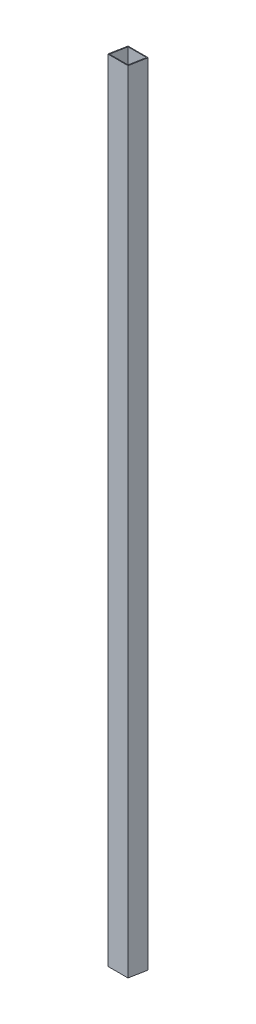
from build123d import *

# Parameters (mm, degrees)
SKETCH1_W           = 25
SKETCH1_H           = 25
SKETCH1_W_2         = 23
SKETCH1_H_2         = 23
BOSS_EXTRUDE1_DEPTH = 1200
CUT_EXTRUDE1_DEPTH  = 1201.325476694


with BuildPart() as part:
    # Sketch1 → Boss-Extrude1 (new body)
    with BuildSketch(Plane(origin=(0, 0, 0), x_dir=(1, 0, 0), z_dir=(0, 1, 0))):
        Rectangle(SKETCH1_W, SKETCH1_H)
        Rectangle(SKETCH1_W_2, SKETCH1_H_2, mode=Mode.SUBTRACT)
    extrude(amount=BOSS_EXTRUDE1_DEPTH)

    # Sketch2 → Cut-Extrude1 (cut, through all)
    with BuildSketch(Plane(origin=(12.5, 0, 0), x_dir=(0, 0, -1), z_dir=(1, 0, 0))):
        Polygon((12.5, 0), (-12.5, 3.959611008), (-12.5, 0), align=None)
        Polygon((12.5, 1200), (-12.5, 1200), (-12.5, 980.988457394), (12.5, 977.028846385), align=None)
    extrude(amount=-CUT_EXTRUDE1_DEPTH, mode=Mode.SUBTRACT)


solid = part.part
